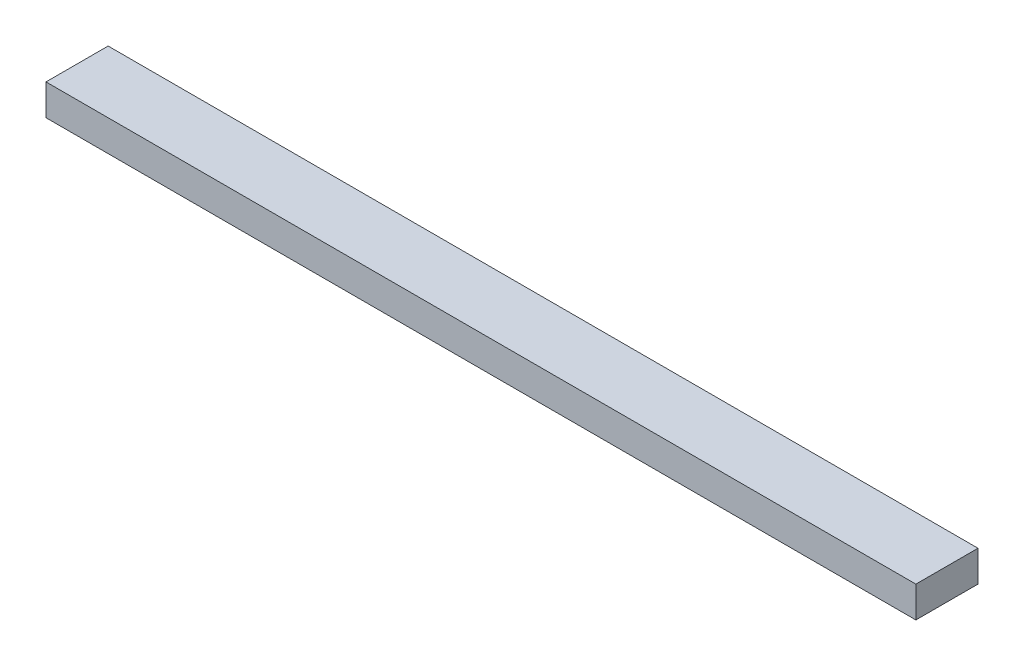
from build123d import *

# Parameters (mm, degrees)
SKETCH_1_W      = 40
SKETCH_1_H      = 20
EXTRUDE_1_DEPTH = 560


with BuildPart() as part:
    # Эскиз1 → Бобышка-Вытянуть1 (new body)
    with BuildSketch(Plane(origin=(0, 0, 0), x_dir=(0, 0, -1), z_dir=(1, 0, 0))):
        with Locations((375.62175711, 619.071886436)):
            Rectangle(SKETCH_1_W, SKETCH_1_H)
    extrude(amount=EXTRUDE_1_DEPTH)


solid = part.part
